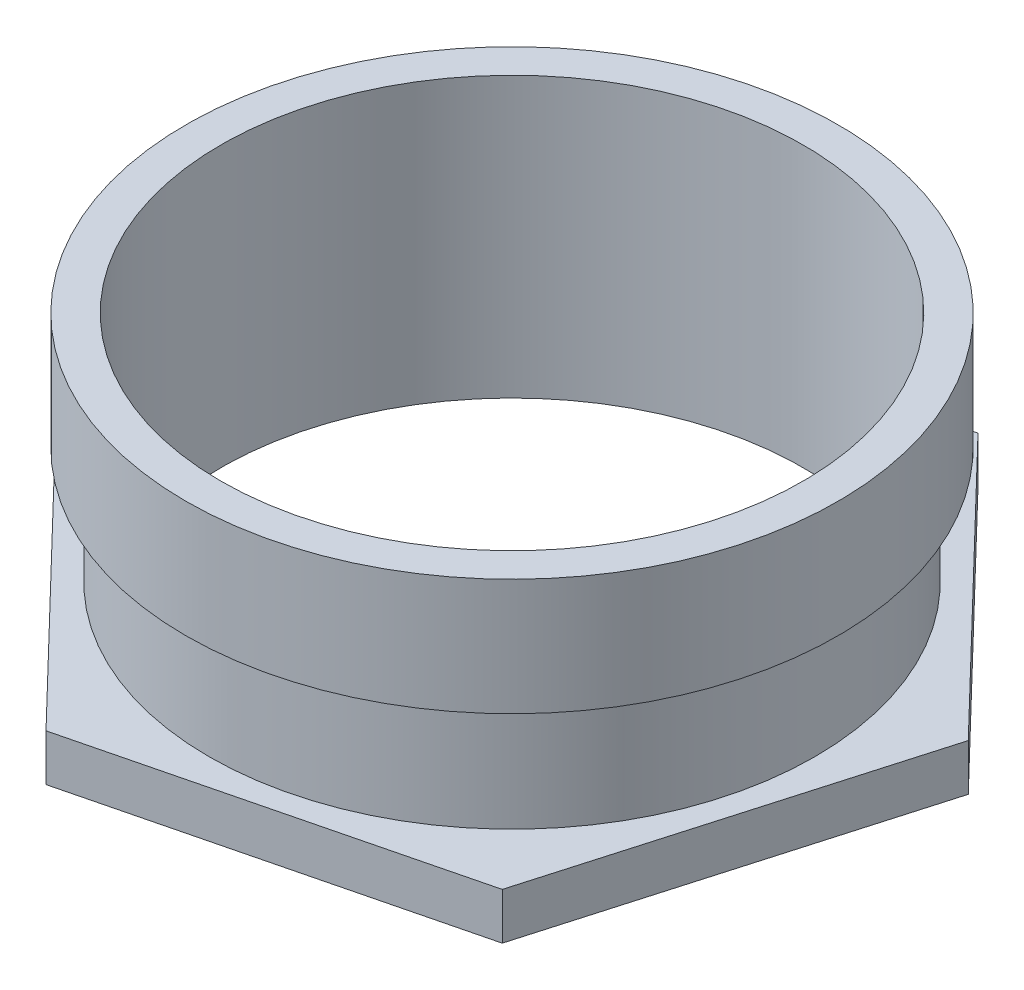
from build123d import *

# Parameters (mm, degrees)
SKETCH_1_R      = 12.5
EXTRUDE_1_DEPTH = 2
SKETCH_2_R      = 13
SKETCH_2_R_2    = 12.5
EXTRUDE_2_DEPTH = 5
SKETCH_3_R      = 14
SKETCH_3_R_2    = 12.5
EXTRUDE_3_DEPTH = 5


with BuildPart() as part:
    # 草圖1 → 填料-伸長1 (new body)
    with BuildSketch(Plane(origin=(0, 0, 0), x_dir=(1, 0, 0), z_dir=(0, 1, 0))):
        Polygon((-4.468973219, -15.535817059), (11.219925632, -11.638152866), (15.688898852, 3.897664193), (4.468973219, 15.535817059), (-11.219925632, 11.638152866), (-15.688898852, -3.897664193), align=None)
        with Locations(Location((0, 0, 0), (0, 0, 270))):
            Circle(SKETCH_1_R, mode=Mode.SUBTRACT)
    extrude(amount=EXTRUDE_1_DEPTH)

    # 草圖2 → 填料-伸長2 (add)
    with BuildSketch(Plane(origin=(0, 2, 0), x_dir=(1, 0, 0), z_dir=(0, 1, 0))):
        with Locations(Location((0, 0, 0), (0, 0, 270))):
            Circle(SKETCH_2_R)
        with Locations(Location((0, 0, 0), (0, 0, 270))):
            Circle(SKETCH_2_R_2, mode=Mode.SUBTRACT)
    extrude(amount=EXTRUDE_2_DEPTH)

    # 草圖3 → 填料-伸長3 (add)
    with BuildSketch(Plane(origin=(0, 7, 0), x_dir=(1, 0, 0), z_dir=(0, 1, 0))):
        with Locations(Location((0, 0, 0), (0, 0, 270))):
            Circle(SKETCH_3_R)
        with Locations(Location((0, 0, 0), (0, 0, 270))):
            Circle(SKETCH_3_R_2, mode=Mode.SUBTRACT)
    extrude(amount=EXTRUDE_3_DEPTH)


solid = part.part
